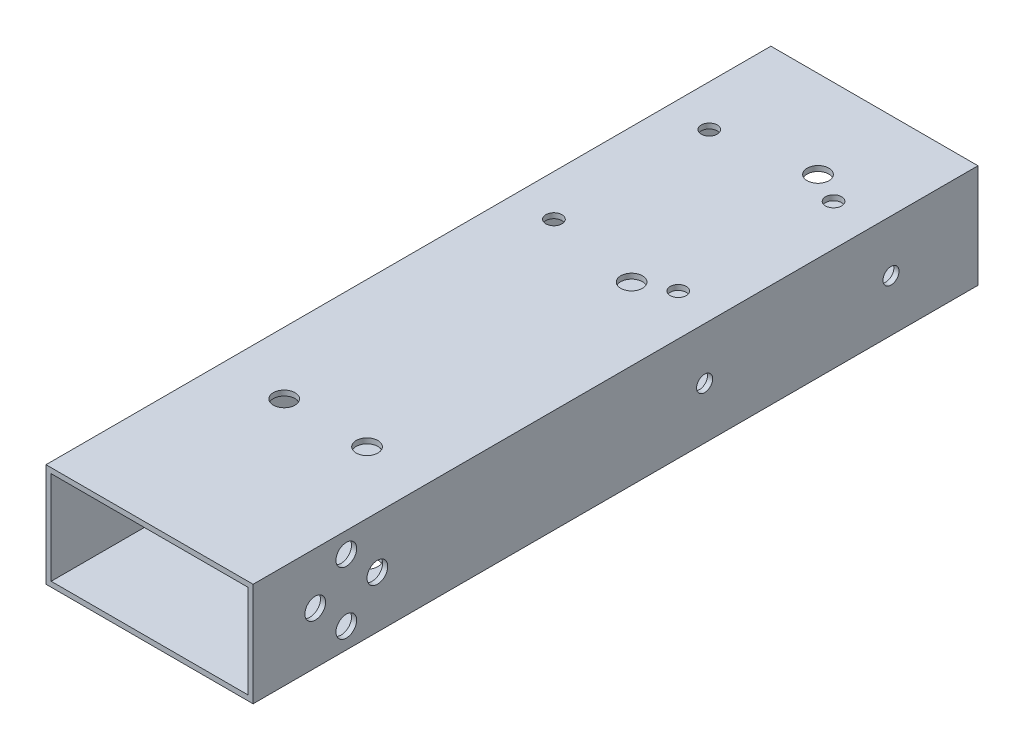
from build123d import *

# Parameters (mm, degrees)
SKETCH_1_W          = 40
SKETCH_1_H          = 20
SKETCH_1_W_2        = 38
SKETCH_1_H_2        = 18
EXTRUDE_1_DEPTH     = 140
SKETCH_2_R          = 2
SKETCH_2_R_2        = 1.55
CUT_EXTRUDE_1_DEPTH = 147.969384567
SKETCH_3_R          = 1.55
SKETCH_3_R_2        = 2.1
CUT_EXTRUDE_2_DEPTH = 147.969384567
SKETCH_4_R          = 2.1
CUT_EXTRUDE_3_DEPTH = 147.969384567


with BuildPart() as part:
    # 草图1 → 凸台-拉伸1 (new body)
    with BuildSketch(Plane.XY):
        with Locations((20, 10)):
            Rectangle(SKETCH_1_W, SKETCH_1_H)
        with Locations((20, 10)):
            Rectangle(SKETCH_1_W_2, SKETCH_1_H_2, mode=Mode.SUBTRACT)
    extrude(amount=EXTRUDE_1_DEPTH)

    # 草图2 → 切除-拉伸1 (cut, through all)
    with BuildSketch(Plane(origin=(0, 0, 0), x_dir=(0, 0, -1), z_dir=(1, 0, 0))):
        with Locations(Location((-116, 10, 0), (0, 0, 180))):
            Circle(SKETCH_2_R)
        with Locations(Location((-128, 10, 0), (0, 0, 180))):
            Circle(SKETCH_2_R)
        with Locations(Location((-16.8, 10, 0), (0, 0, 180))):
            Circle(SKETCH_2_R_2)
        with Locations(Location((-52.8, 10, 0), (0, 0, 180))):
            Circle(SKETCH_2_R_2)
        with Locations(Location((-122, 16, 0), (0, 0, 180))):
            Circle(SKETCH_2_R)
        with Locations(Location((-122, 4, 0), (0, 0, 180))):
            Circle(SKETCH_2_R)
    extrude(amount=CUT_EXTRUDE_1_DEPTH, mode=Mode.SUBTRACT)

    # 草图3 → 切除-拉伸2 (cut, through all)
    with BuildSketch(Plane(origin=(0, 0, 0), x_dir=(1, 0, 0), z_dir=(0, 1, 0))):
        with Locations(Location((8, -19.9, 0), (0, 0, 90))):
            Circle(SKETCH_3_R)
        with Locations(Location((32, -19.9, 0), (0, 0, 90))):
            Circle(SKETCH_3_R)
        with Locations(Location((32, -49.9, 0), (0, 0, 90))):
            Circle(SKETCH_3_R)
        with Locations(Location((8, -49.9, 0), (0, 0, 90))):
            Circle(SKETCH_3_R)
        with Locations(Location((26, -16.9, 0), (0, 0, 90))):
            Circle(SKETCH_3_R_2)
        with Locations(Location((26, -52.9, 0), (0, 0, 90))):
            Circle(SKETCH_3_R_2)
    extrude(amount=CUT_EXTRUDE_2_DEPTH, mode=Mode.SUBTRACT)

    # 草图4 → 切除-拉伸3 (cut, through all)
    with BuildSketch(Plane(origin=(0, 20, 0), x_dir=(1, 0, 0), z_dir=(0, 1, 0))):
        with Locations(Location((28, -106, 0), (0, 0, 270))):
            Circle(SKETCH_4_R)
        with Locations(Location((12, -106, 0), (0, 0, 270))):
            Circle(SKETCH_4_R)
    extrude(amount=-CUT_EXTRUDE_3_DEPTH, mode=Mode.SUBTRACT)


solid = part.part
